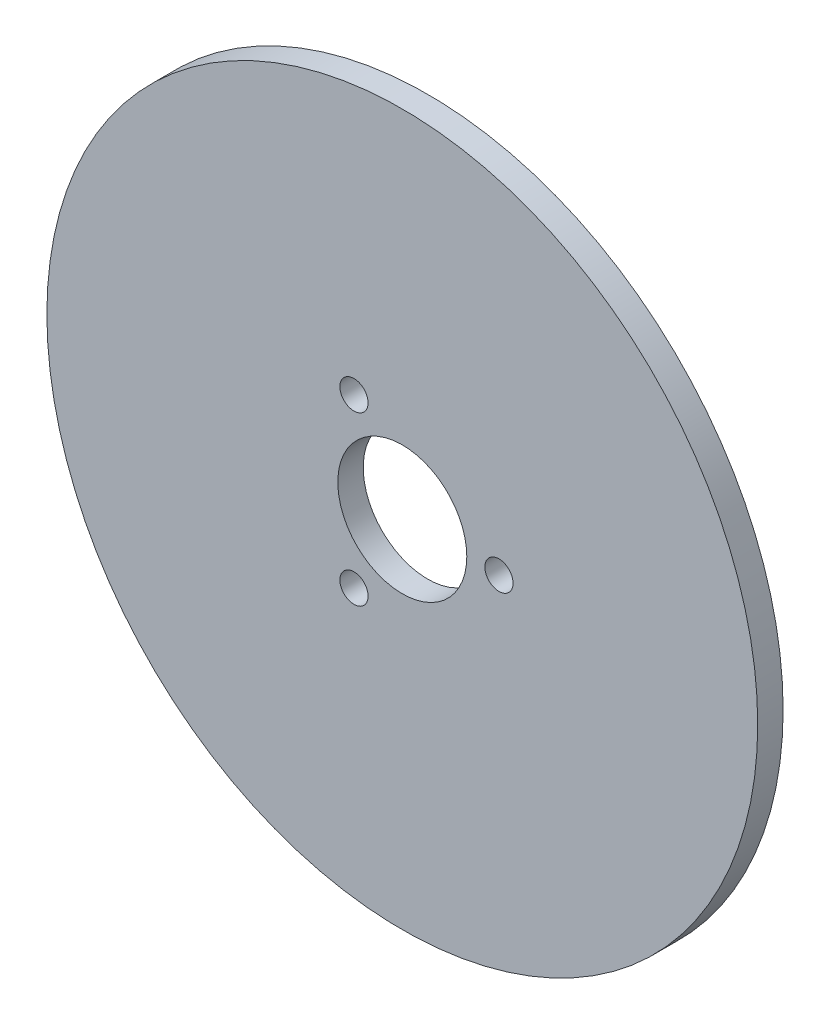
from build123d import *

# Parameters (mm, degrees)
SKETCH1_R               = 70
SKETCH1_R_2             = 12.7
BOSS_EXTRUDE1_DEPTH     = 5
CUT_EXTRUDE1_DEPTH      = 100.121138008
CUT_EXTRUDE1_DEPTH_BACK = 100.121138008
SKETCH3_R               = 2.778125


with BuildPart() as part:
    # Sketch1 → Boss-Extrude1 (new body)
    with BuildSketch(Plane.XY):
        Circle(SKETCH1_R)
        Circle(SKETCH1_R_2, mode=Mode.SUBTRACT)
    extrude(amount=BOSS_EXTRUDE1_DEPTH)

    # Sketch3 → Cut-Extrude1 (cut, two sides: drawn at the far end of the back side and taken through both)
    with BuildSketch(Plane.XY.offset(5).offset(-CUT_EXTRUDE1_DEPTH_BACK)):
        with Locations((-9.5170625, 16.484035789)):
            Circle(SKETCH3_R)
        with Locations((19.034125, 0)):
            Circle(SKETCH3_R)
        with Locations((-9.5170625, -16.484035789)):
            Circle(SKETCH3_R)
    extrude(amount=CUT_EXTRUDE1_DEPTH + CUT_EXTRUDE1_DEPTH_BACK, mode=Mode.SUBTRACT)


solid = part.part
